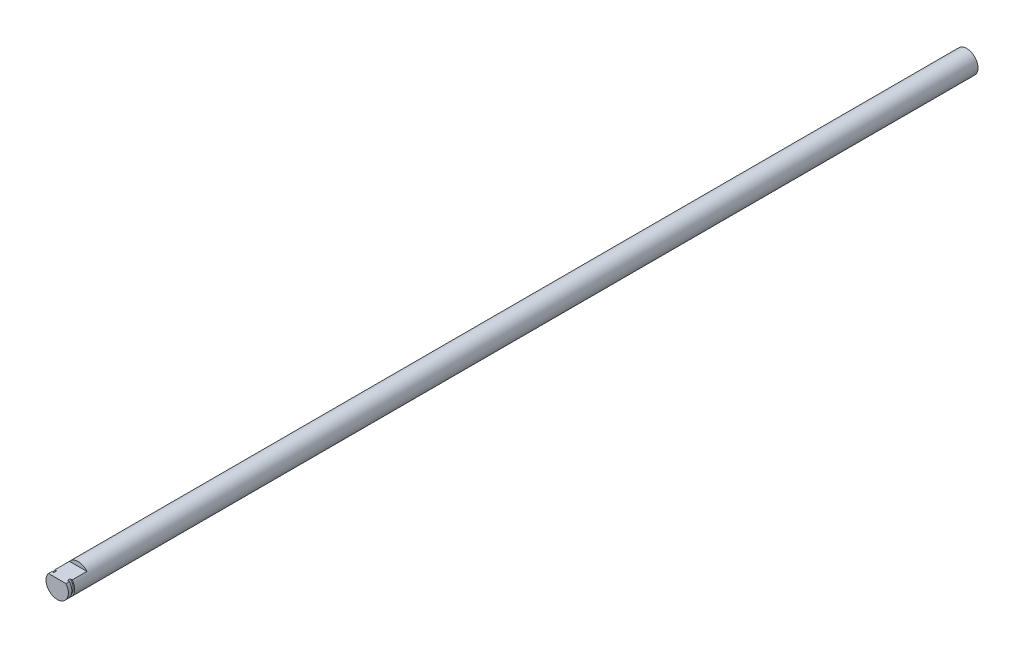
from build123d import *

# Parameters (mm, degrees)
SKETCH1_R           = 4
BOSS_EXTRUDE1_DEPTH = 325
CUT_EXTRUDE1_START  = -7.5
CUT_EXTRUDE1_DEPTH  = 7.5
CUT_EXTRUDE2_START  = -1
SKETCH3_R           = 4
SKETCH3_R_2         = 3.5
CUT_EXTRUDE2_DEPTH  = 1


with BuildPart() as part:
    # Sketch1 → Boss-Extrude1 (new body)
    with BuildSketch(Plane.XY):
        Circle(SKETCH1_R)
    extrude(amount=BOSS_EXTRUDE1_DEPTH)

    # Sketch2 → Cut-Extrude1 (cut)
    with BuildSketch(Plane.XY.offset(325).offset(CUT_EXTRUDE1_START)):
        with BuildLine():
            Line((3.122498999, 2.5), (-3.122498999, 2.5))
            ThreePointArc((-3.122498999, 2.5), (0, 4), (3.122498999, 2.5))
        make_face()
    extrude(amount=CUT_EXTRUDE1_DEPTH, mode=Mode.SUBTRACT)

    # Sketch3 → Cut-Extrude2 (cut)
    with BuildSketch(Plane.XY.offset(323.75).offset(CUT_EXTRUDE2_START)):
        with Locations(Location((0, 0, 0), (0, 0, 141.317812547))):
            Circle(SKETCH3_R)
        Circle(SKETCH3_R_2, mode=Mode.SUBTRACT)
    extrude(amount=CUT_EXTRUDE2_DEPTH, mode=Mode.SUBTRACT)


solid = part.part
